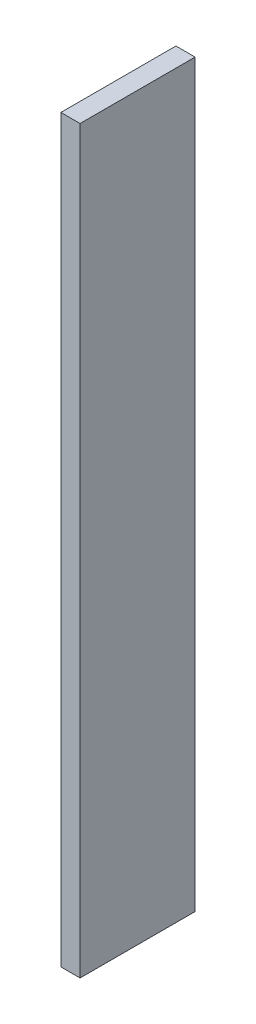
from build123d import *

# Parameters (mm, degrees)
SKETCH_1_W      = 5
SKETCH_1_H      = 30
EXTRUDE_1_DEPTH = 193


with BuildPart() as part:
    # Эскиз1 → Бобышка-Вытянуть1 (new body)
    with BuildSketch(Plane(origin=(0, 0, 0), x_dir=(1, 0, 0), z_dir=(0, 1, 0))):
        with Locations((2.5, -15)):
            Rectangle(SKETCH_1_W, SKETCH_1_H)
    extrude(amount=EXTRUDE_1_DEPTH)


solid = part.part
